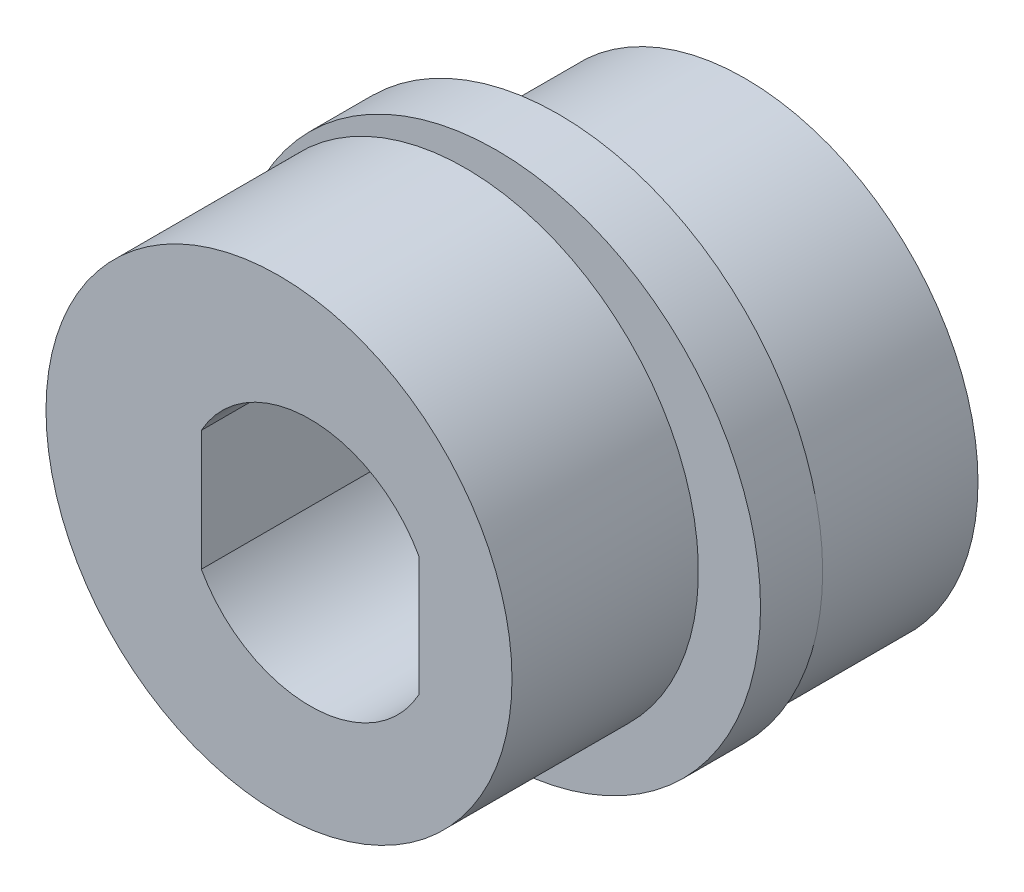
from build123d import *

# Parameters (mm, degrees)
SKETCH1_R           = 7.5
BOSS_EXTRUDE1_DEPTH = 6
SKETCH2_R           = 7.5
BOSS_EXTRUDE2_DEPTH = 7
CUT_EXTRUDE1_DEPTH  = 14.322912594
BOSS_EXTRUDE3_START = 2
SKETCH4_R           = 8.5
BOSS_EXTRUDE3_DEPTH = 2


with BuildPart() as part:
    # Sketch1 → Boss-Extrude1 (new body)
    with BuildSketch(Plane.XY):
        with Locations((-1, 0)):
            Circle(SKETCH1_R)
        with BuildLine():
            Line((3.5, -1.936491673), (3.5, 1.936491673))
            ThreePointArc((3.5, 1.936491673), (0, 4), (-3.5, 1.936491673))
            Line((-3.5, 1.936491673), (-3.5, -1.936491673))
            ThreePointArc((-3.5, -1.936491673), (0, -4), (3.5, -1.936491673))
        make_face(mode=Mode.SUBTRACT)
    extrude(amount=BOSS_EXTRUDE1_DEPTH)

    # Sketch2 → Boss-Extrude2 (add)
    with BuildSketch(Plane(origin=(0, 0, 0), x_dir=(-1, 0, 0), z_dir=(0, 0, -1))):
        with Locations((-1, 0)):
            Circle(SKETCH2_R)
    extrude(amount=BOSS_EXTRUDE2_DEPTH)

    # Sketch3 → Cut-Extrude1 (cut, through all)
    with BuildSketch(Plane.XY):
        with BuildLine():
            Line((3.5, -1.936491673), (3.5, 1.936491673))
            ThreePointArc((3.5, 1.936491673), (0, 4), (-3.5, 1.936491673))
            Line((-3.5, 1.936491673), (-3.5, -1.936491673))
            ThreePointArc((-3.5, -1.936491673), (0, -4), (3.5, -1.936491673))
        make_face()
    extrude(amount=-CUT_EXTRUDE1_DEPTH, mode=Mode.SUBTRACT)

    # Sketch4 → Boss-Extrude3 (add)
    with BuildSketch(Plane(origin=(0, 0, 0), x_dir=(-1, 0, 0), z_dir=(0, 0, -1)).offset(BOSS_EXTRUDE3_START)):
        Circle(SKETCH4_R)
        with BuildLine():
            Line((3.5, 1.936491673), (3.5, -1.936491673))
            ThreePointArc((3.5, -1.936491673), (0, -4), (-3.5, -1.936491673))
            Line((-3.5, -1.936491673), (-3.5, 1.936491673))
            ThreePointArc((-3.5, 1.936491673), (0, 4), (3.5, 1.936491673))
        make_face(mode=Mode.SUBTRACT)
    extrude(amount=-BOSS_EXTRUDE3_DEPTH)


solid = part.part
